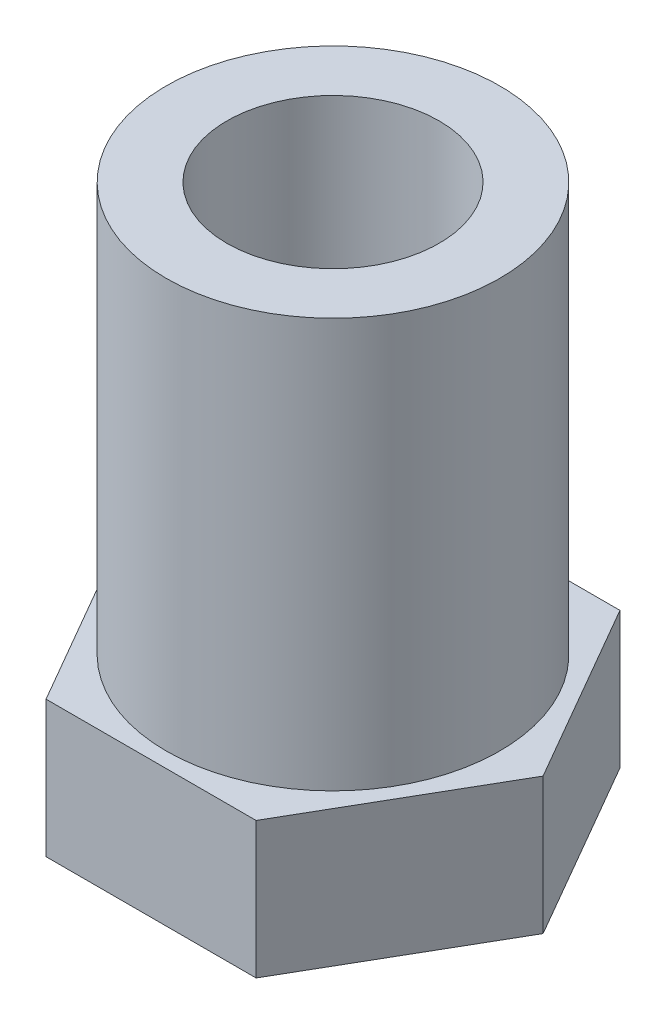
from build123d import *

# Parameters (mm, degrees)
SKETCH_1_R          = 2
EXTRUDE_1_DEPTH     = 18
SKETCH_2_R          = 5.5
SKETCH_2_R_2        = 3.5
CUT_EXTRUDE_2_DEPTH = 13.5


with BuildPart() as part:
    # 草图1 → 凸台-拉伸1 (new body)
    with BuildSketch(Plane(origin=(0, 0, 0), x_dir=(1, 0, 0), z_dir=(0, 1, 0))):
        Polygon((6.92820323, 0), (3.464101615, 6), (-3.464101615, 6), (-6.92820323, 0), (-3.464101615, -6), (3.464101615, -6), align=None)
        with Locations(Location((0, 0, 0), (0, 0, 270))):
            Circle(SKETCH_1_R, mode=Mode.SUBTRACT)
    extrude(amount=EXTRUDE_1_DEPTH)

    # 草图2 → 切除-拉伸2 (cut)
    # profile 1 of 2: a face of its own
    with BuildSketch(Plane(origin=(0, 18, 0), x_dir=(1, 0, 0), z_dir=(0, 1, 0))):
        Polygon((-6.92820323, 0), (-3.464101615, -6), (3.464101615, -6), (6.92820323, 0), (3.464101615, 6), (-3.464101615, 6), align=None)
        with Locations(Location((0, 0, 0), (0, 0, 270))):
            Circle(SKETCH_2_R, mode=Mode.SUBTRACT)
    # profile 2 of 2: a face of its own
    with BuildSketch(Plane(origin=(0, 18, 0), x_dir=(1, 0, 0), z_dir=(0, 1, 0))):
        with Locations(Location((0, 0, 0), (0, 0, 270))):
            Circle(SKETCH_2_R_2)
    extrude(amount=-CUT_EXTRUDE_2_DEPTH, mode=Mode.SUBTRACT)


solid = part.part
